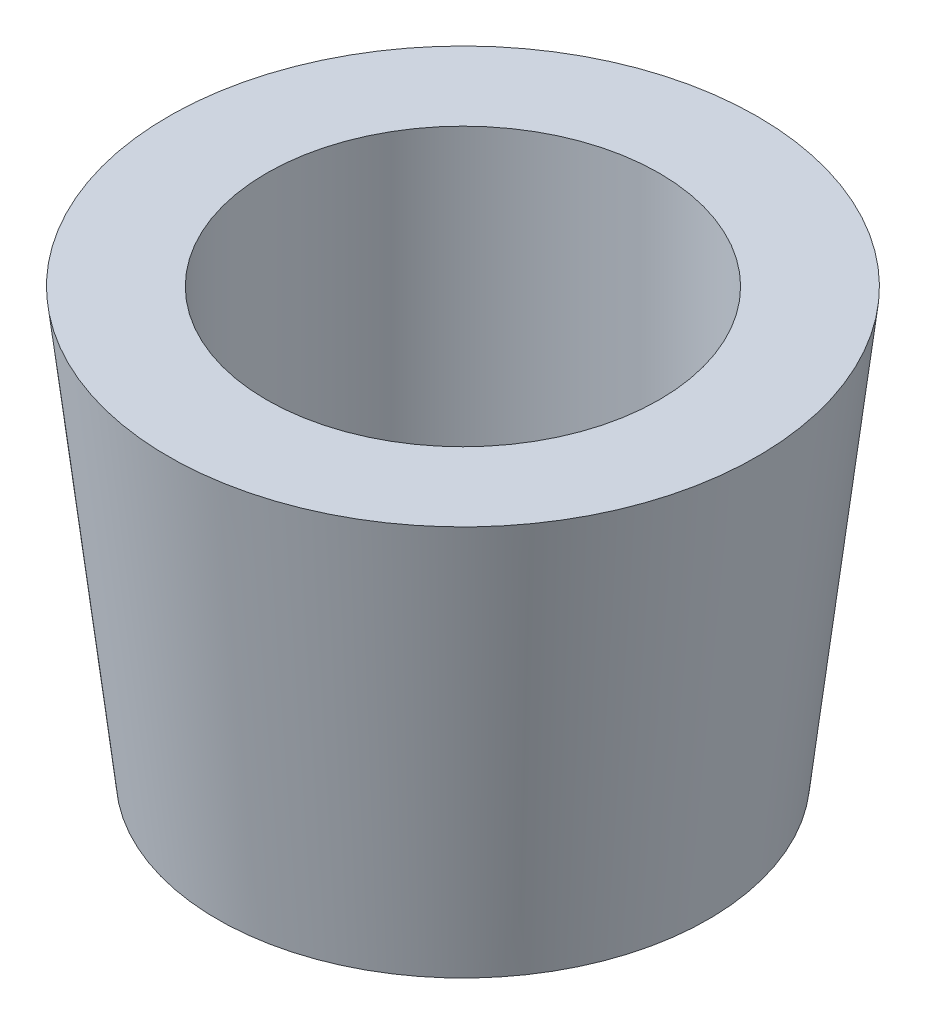
from build123d import *


with BuildPart() as part:
    # Sketch1 → Revolve1 (revolve)
    with BuildSketch(Plane.XY, mode=Mode.PRIVATE) as revolve1_sk:
        Polygon((3, 3.25), (4.5, 3.25), (3.75, -3.25), (3, -3.25), align=None)
    revolve(revolve1_sk.sketch.rotate(Axis((0, 0, 0), (0, 1, 0)), 90), axis=Axis((0, 0, 0), (0, 1, 0)))


solid = part.part
